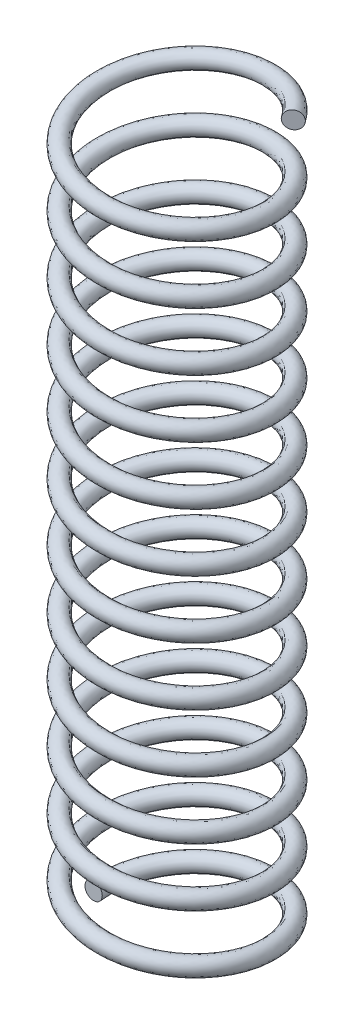
from build123d import *

# Parameters (mm, degrees)
SWEEP1_PITCH       = 4
SWEEP1_HEIGHT      = 49.6062
SWEEP1_RADIUS      = 5.7531
SWEEP1_START_ANGLE = -90
SKETCH2_R          = 0.5969


with BuildPart() as part:
    # Sweep1: sweep along a helix
    with BuildLine() as sweep1_path:
        add(Helix(SWEEP1_PITCH, SWEEP1_HEIGHT, SWEEP1_RADIUS, center=(0, 0, 0), direction=(0, 1, 0), lefthand=True, mode=Mode.PRIVATE).rotate(Axis((0, 0, 0), (0, 1, 0)), SWEEP1_START_ANGLE))
    # Sketch2 → Sweep1 (sweep)
    with BuildSketch(Plane.XY):
        with Locations((-5.7531, 0)):
            Circle(SKETCH2_R)
    sweep(path=sweep1_path.line, is_frenet=True)


solid = part.part
